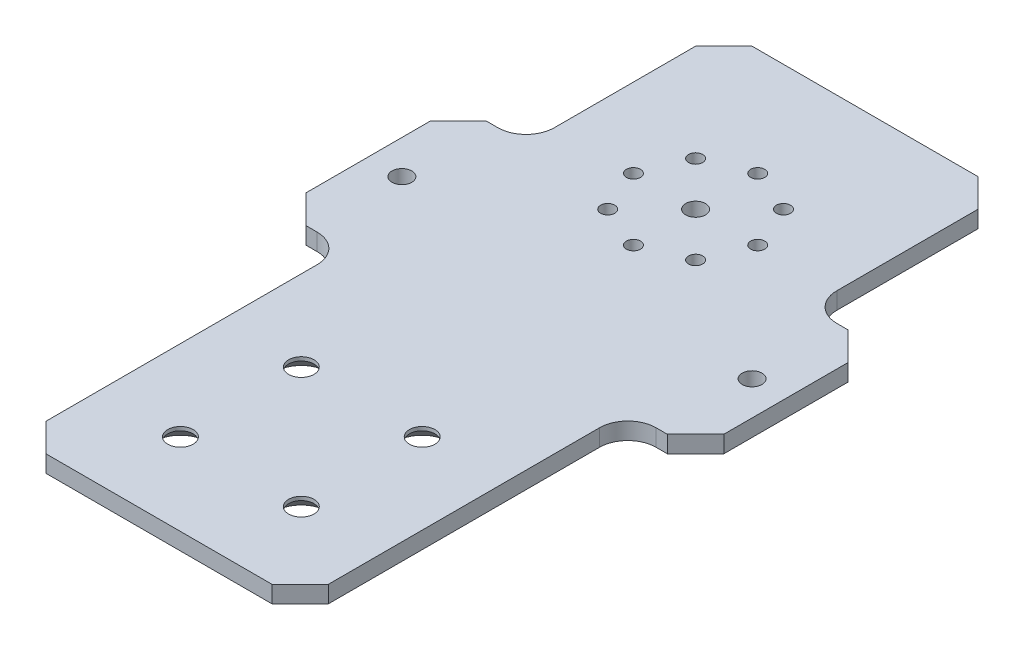
from build123d import *

# Parameters (mm, degrees)
SKETCH1_W                                    = 50
SKETCH1_H                                    = 125
BOSS_EXTRUDE1_DEPTH                          = 3
SKETCH2_R                                    = 1.75
CUT_EXTRUDE1_DEPTH                           = 10
SKETCH14_R                                   = 2
CUT_EXTRUDE16_DEPTH                          = 10
CSK_FOR_M4_HEX_SOCKET_COUNTERSUNK_HE_2_COUNT = 2
CSK_FOR_M4_HEX_SOCKET_COUNTERSUNK_HE_2_PITCH = 21.4
CSK_FOR_M4_HEX_SOCKET_COUNTERSUNK_HE_3_COUNT = 2
CSK_FOR_M4_HEX_SOCKET_COUNTERSUNK_HE_3_PITCH = 30.264170235
CSK_FOR_M4_HEX_SOCKET_COUNTERSUNK_HE_4_COUNT = 2
CSK_FOR_M4_HEX_SOCKET_COUNTERSUNK_HE_4_PITCH = 21.4
CUT_EXTRUDE17_REACH                          = 69.381
SKETCH18_R                                   = 1.25
CHAMFER1_SIZE                                = 5
SKETCH19_W                                   = 12
SKETCH19_H                                   = 32
BOSS_EXTRUDE2_DEPTH                          = 3
CHAMFER2_SIZE                                = 5
FILLET1_R                                    = 5
SKETCH20_R                                   = 1.75
CUT_EXTRUDE18_DEPTH                          = 73.692846966


with BuildPart() as part:
    # Sketch1 → Boss-Extrude1 (new body)
    with BuildSketch(Plane(origin=(0, 0, 0), x_dir=(1, 0, 0), z_dir=(0, 1, 0))):
        Rectangle(SKETCH1_W, SKETCH1_H)
    extrude(amount=BOSS_EXTRUDE1_DEPTH)

    # Sketch2 → Cut-Extrude1 (cut)
    with BuildSketch(Plane(origin=(0, 3, 0), x_dir=(1, 0, 0), z_dir=(0, 1, 0))):
        with Locations(Location((0, 32.5, 0), (0, 0, 270))):
            Circle(SKETCH2_R)
    extrude(amount=-CUT_EXTRUDE1_DEPTH, mode=Mode.SUBTRACT)

    # Sketch14 → Cut-Extrude16 (cut)
    with BuildSketch(Plane(origin=(0, 3, 0), x_dir=(1, 0, 0), z_dir=(0, 1, 0))):
        with Locations(Location((-10.7, -26.6, 0), (0, 0, 270))):
            Circle(SKETCH14_R)
        with Locations(Location((10.7, -26.6, 0), (0, 0, 270))):
            Circle(SKETCH14_R)
        with Locations(Location((10.7, -48, 0), (0, 0, 270))):
            Circle(SKETCH14_R)
        with Locations(Location((-10.7, -48, 0), (0, 0, 270))):
            Circle(SKETCH14_R)
    extrude(amount=-CUT_EXTRUDE16_DEPTH, mode=Mode.SUBTRACT)

    # Sketch15 → CSK for M4 Hex Socket Countersunk Head Screw1 (revolve, cut)
    with BuildSketch(Plane(origin=(-10.7, 0, 26.6), x_dir=(0, 0, -1), z_dir=(1, 0, 0))):
        Polygon((0, 0), (0, 3), (2.25, 3), (2.25, 2.34), (4.59, 0), align=None)
    csk_for_m4_hex_socket_countersunk_head_s = revolve(axis=Axis((-10.7, -6.35, 26.6), (0, 1, 0)), mode=Mode.SUBTRACT)

    # CSK for M4 Hex Socket Countersunk He 2: CSK for M4 Hex Socket Countersunk Head Screw1 ×2
    with Locations(*[(i * CSK_FOR_M4_HEX_SOCKET_COUNTERSUNK_HE_2_PITCH, 0, 0) for i in range(1, CSK_FOR_M4_HEX_SOCKET_COUNTERSUNK_HE_2_COUNT)]):
        add(csk_for_m4_hex_socket_countersunk_head_s, mode=Mode.SUBTRACT)

    # CSK for M4 Hex Socket Countersunk He 3: CSK for M4 Hex Socket Countersunk Head Screw1 ×2
    with Locations(*[Vector(0.7071067811865474, 0, 0.7071067811865477) * (i * CSK_FOR_M4_HEX_SOCKET_COUNTERSUNK_HE_3_PITCH) for i in range(1, CSK_FOR_M4_HEX_SOCKET_COUNTERSUNK_HE_3_COUNT)]):
        add(csk_for_m4_hex_socket_countersunk_head_s, mode=Mode.SUBTRACT)

    # CSK for M4 Hex Socket Countersunk He 4: CSK for M4 Hex Socket Countersunk Head Screw1 ×2
    with Locations(*[(0, 0, i * CSK_FOR_M4_HEX_SOCKET_COUNTERSUNK_HE_4_PITCH) for i in range(1, CSK_FOR_M4_HEX_SOCKET_COUNTERSUNK_HE_4_COUNT)]):
        add(csk_for_m4_hex_socket_countersunk_head_s, mode=Mode.SUBTRACT)

    # Sketch18 → Cut-Extrude17 (cut, up to next)
    with BuildSketch(Plane.XZ, mode=Mode.PRIVATE) as cut_extrude17_sk1:
        with Locations(Location((0, -21.5, 0), (0, 0, 270))):
            Circle(SKETCH18_R)
    cut_extrude17_tool1 = extrude(cut_extrude17_sk1.sketch, amount=-CUT_EXTRUDE17_REACH, mode=Mode.PRIVATE) & part.part
    # Sketch18 → Cut-Extrude17 (cut, up to next)
    with BuildSketch(Plane.XZ, mode=Mode.PRIVATE) as cut_extrude17_sk2:
        with Locations(Location((0, -43.5, 0), (0, 0, 270))):
            Circle(SKETCH18_R)
    cut_extrude17_tool2 = extrude(cut_extrude17_sk2.sketch, amount=-CUT_EXTRUDE17_REACH, mode=Mode.PRIVATE) & part.part
    # Sketch18 → Cut-Extrude17 (cut, up to next)
    with BuildSketch(Plane.XZ, mode=Mode.PRIVATE) as cut_extrude17_sk3:
        with Locations(Location((-11, -32.5, 0), (0, 0, 270))):
            Circle(SKETCH18_R)
    cut_extrude17_tool3 = extrude(cut_extrude17_sk3.sketch, amount=-CUT_EXTRUDE17_REACH, mode=Mode.PRIVATE) & part.part
    # Sketch18 → Cut-Extrude17 (cut, up to next)
    with BuildSketch(Plane.XZ, mode=Mode.PRIVATE) as cut_extrude17_sk4:
        with Locations(Location((11, -32.5, 0), (0, 0, 270))):
            Circle(SKETCH18_R)
    cut_extrude17_tool4 = extrude(cut_extrude17_sk4.sketch, amount=-CUT_EXTRUDE17_REACH, mode=Mode.PRIVATE) & part.part
    # Sketch18 → Cut-Extrude17 (cut, up to next)
    with BuildSketch(Plane.XZ, mode=Mode.PRIVATE) as cut_extrude17_sk5:
        with Locations(Location((7.778174593, -24.721825407, 0), (0, 0, 270))):
            Circle(SKETCH18_R)
    cut_extrude17_tool5 = extrude(cut_extrude17_sk5.sketch, amount=-CUT_EXTRUDE17_REACH, mode=Mode.PRIVATE) & part.part
    # Sketch18 → Cut-Extrude17 (cut, up to next)
    with BuildSketch(Plane.XZ, mode=Mode.PRIVATE) as cut_extrude17_sk6:
        with Locations(Location((-7.778174593, -24.721825407, 0), (0, 0, 270))):
            Circle(SKETCH18_R)
    cut_extrude17_tool6 = extrude(cut_extrude17_sk6.sketch, amount=-CUT_EXTRUDE17_REACH, mode=Mode.PRIVATE) & part.part
    # Sketch18 → Cut-Extrude17 (cut, up to next)
    with BuildSketch(Plane.XZ, mode=Mode.PRIVATE) as cut_extrude17_sk7:
        with Locations(Location((-7.778174593, -40.278174593, 0), (0, 0, 270))):
            Circle(SKETCH18_R)
    cut_extrude17_tool7 = extrude(cut_extrude17_sk7.sketch, amount=-CUT_EXTRUDE17_REACH, mode=Mode.PRIVATE) & part.part
    # Sketch18 → Cut-Extrude17 (cut, up to next)
    with BuildSketch(Plane.XZ, mode=Mode.PRIVATE) as cut_extrude17_sk8:
        with Locations(Location((7.778174593, -40.278174593, 0), (0, 0, 270))):
            Circle(SKETCH18_R)
    cut_extrude17_tool8 = extrude(cut_extrude17_sk8.sketch, amount=-CUT_EXTRUDE17_REACH, mode=Mode.PRIVATE) & part.part
    add(cut_extrude17_tool1.solids().sort_by_distance((0, 0, -21.5))[0], mode=Mode.SUBTRACT)
    add(cut_extrude17_tool2.solids().sort_by_distance((0, 0, -43.5))[0], mode=Mode.SUBTRACT)
    add(cut_extrude17_tool3.solids().sort_by_distance((-11, 0, -32.5))[0], mode=Mode.SUBTRACT)
    add(cut_extrude17_tool4.solids().sort_by_distance((11, 0, -32.5))[0], mode=Mode.SUBTRACT)
    add(cut_extrude17_tool5.solids().sort_by_distance((7.778175, 0, -24.721825))[0], mode=Mode.SUBTRACT)
    add(cut_extrude17_tool6.solids().sort_by_distance((-7.778175, 0, -24.721825))[0], mode=Mode.SUBTRACT)
    add(cut_extrude17_tool7.solids().sort_by_distance((-7.778175, 0, -40.278175))[0], mode=Mode.SUBTRACT)
    add(cut_extrude17_tool8.solids().sort_by_distance((7.778175, 0, -40.278175))[0], mode=Mode.SUBTRACT)

    # Chamfer1
    chamfer1_edges = [part.edges().sort_by_distance(p)[0] for p in [
        (-25, 1.5, -62.5),
        (25, 1.5, -62.5),
        (25, 1.5, 62.5),
        (-25, 1.5, 62.5),
    ]]
    chamfer(chamfer1_edges, length=CHAMFER1_SIZE)

    # Sketch19 → Boss-Extrude2 (add)
    with BuildSketch(Plane(origin=(0, 3, 0), x_dir=(1, 0, 0), z_dir=(0, 1, 0))):
        with Locations((-31, 11.5)):
            Rectangle(SKETCH19_W, SKETCH19_H)
        with Locations((31, 11.5)):
            Rectangle(SKETCH19_W, SKETCH19_H)
    extrude(amount=-BOSS_EXTRUDE2_DEPTH)

    # Chamfer2
    chamfer2_edges = [part.edges().sort_by_distance(p)[0] for p in [
        (37, 1.5, -27.5),
        (37, 1.5, 4.5),
        (-37, 1.5, -27.5),
        (-37, 1.5, 4.5),
    ]]
    chamfer(chamfer2_edges, length=CHAMFER2_SIZE)

    # Fillet1
    fillet1_edges = [part.edges().sort_by_distance(p)[0] for p in [
        (-25, 1.5, -27.5),
        (-25, 1.5, 4.5),
        (25, 1.5, -27.5),
        (25, 1.5, 4.5),
    ]]
    fillet(fillet1_edges, radius=FILLET1_R)

    # Sketch20 → Cut-Extrude18 (cut, through all)
    with BuildSketch(Plane(origin=(0, 3, 0), x_dir=(1, 0, 0), z_dir=(0, 1, 0))):
        with Locations(Location((-31, 11.5, 0), (0, 0, 270))):
            Circle(SKETCH20_R)
        with Locations(Location((31, 11.5, 0), (0, 0, 90))):
            Circle(SKETCH20_R)
    extrude(amount=-CUT_EXTRUDE18_DEPTH, mode=Mode.SUBTRACT)


solid = part.part
